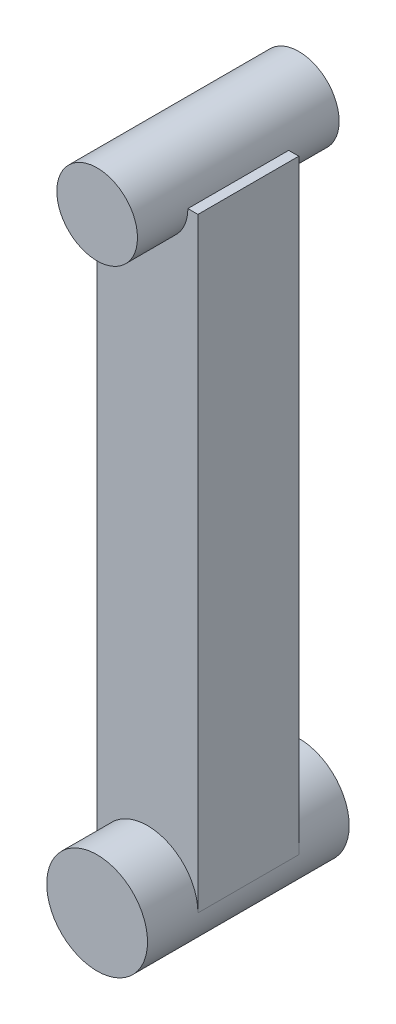
from build123d import *

# Parameters (mm, degrees)
SKETCH1_W                = 30
SKETCH1_H                = 30
BOSS_EXTRUDE1_DEPTH      = 180
BOSS_EXTRUDE2_DEPTH      = 30
BOSS_EXTRUDE2_DEPTH_BACK = 30
SKETCH2_R                = 15
SKETCH2_R_2              = 12


with BuildPart() as part:
    # Sketch1 → Boss-Extrude1 (new body)
    with BuildSketch(Plane(origin=(0, 0, 0), x_dir=(1, 0, 0), z_dir=(0, 1, 0))):
        Rectangle(SKETCH1_W, SKETCH1_H)
    extrude(amount=BOSS_EXTRUDE1_DEPTH)

    # Sketch2 → Boss-Extrude2 (add, two sides: drawn at the far end of the back side and taken through both)
    with BuildSketch(Plane.XY.offset(-BOSS_EXTRUDE2_DEPTH_BACK)):
        Circle(SKETCH2_R)
        with Locations((0, 180)):
            Circle(SKETCH2_R_2)
    extrude(amount=BOSS_EXTRUDE2_DEPTH + BOSS_EXTRUDE2_DEPTH_BACK)


solid = part.part
